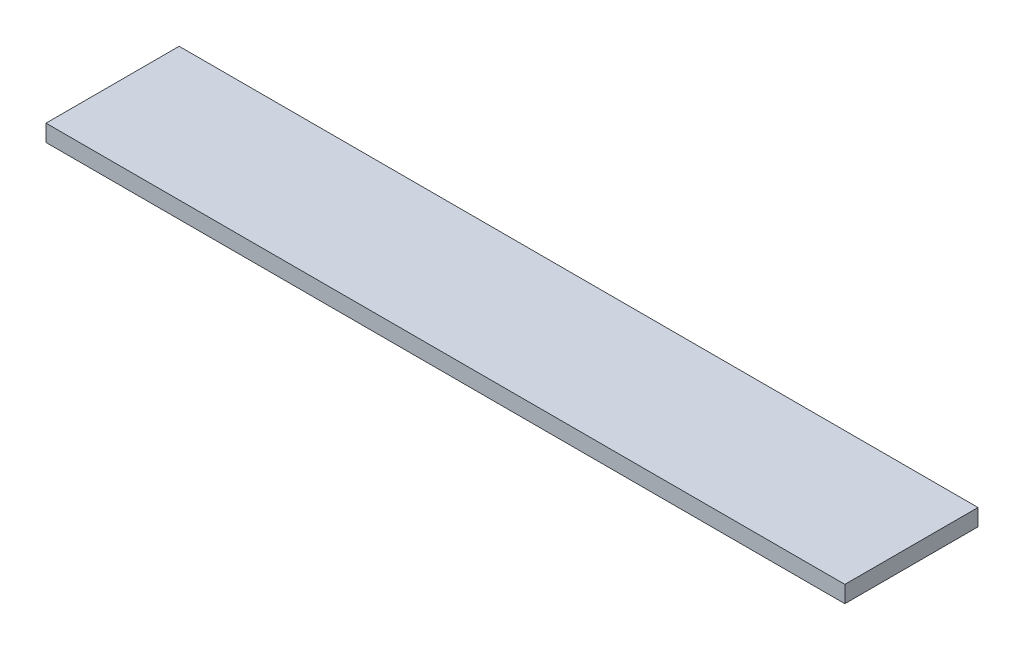
from build123d import *

# Parameters (mm, degrees)
SKETCH1_W           = 76.2
SKETCH1_H           = 12.7
BOSS_EXTRUDE1_DEPTH = 1.6002


with BuildPart() as part:
    # Sketch1 → Boss-Extrude1 (new body)
    with BuildSketch(Plane(origin=(0, 0, 0), x_dir=(1, 0, 0), z_dir=(0, 1, 0))):
        Rectangle(SKETCH1_W, SKETCH1_H)
    extrude(amount=BOSS_EXTRUDE1_DEPTH)


solid = part.part
